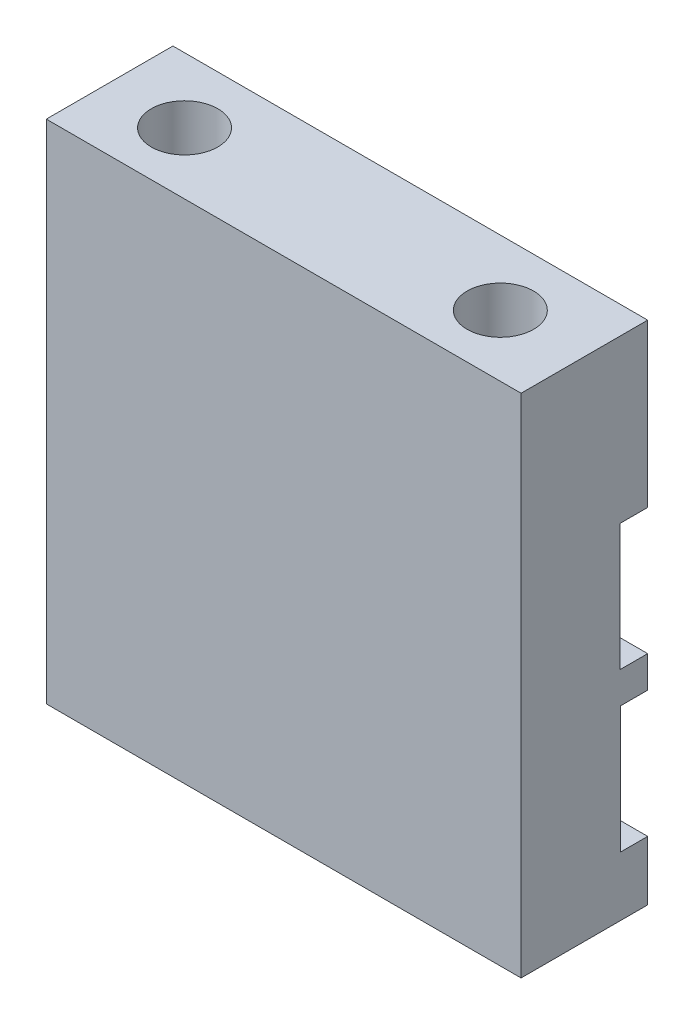
from build123d import *

# Parameters (mm, degrees)
BOSS_EXTRUDE1_DEPTH      = 8
BOSS_EXTRUDE1_DEPTH_BACK = 0.001
SKETCH1_W                = 30
SKETCH1_H                = 32
SKETCH3_W                = 1.75
SKETCH3_H                = 8
SKETCH3_W_2              = 1.716544358
CUT_EXTRUDE1_DEPTH       = 35.928498393
SKETCH4_R                = 2.1
CUT_EXTRUDE2_DEPTH       = 6


with BuildPart() as part:
    # Sketch1 → Boss-Extrude1 (new, two sides: drawn at the far end of the back side and taken through both)
    with BuildSketch(Plane.XY.offset(-BOSS_EXTRUDE1_DEPTH_BACK)):
        Rectangle(SKETCH1_W, SKETCH1_H)
    extrude(amount=BOSS_EXTRUDE1_DEPTH + BOSS_EXTRUDE1_DEPTH_BACK)

    # Sketch3 → Cut-Extrude1 (cut, through all)
    with BuildSketch(Plane.ZY.offset(15)):
        with Locations((0.874, 1.75)):
            Rectangle(SKETCH3_W, SKETCH3_H)
        with Locations((0.857272179, -8.249968909)):
            Rectangle(SKETCH3_W_2, SKETCH3_H)
    extrude(amount=-CUT_EXTRUDE1_DEPTH, mode=Mode.SUBTRACT)

    # Sketch4 → Cut-Extrude2 (cut)
    with BuildSketch(Plane(origin=(0, 16, 0), x_dir=(1, 0, 0), z_dir=(0, 1, 0))):
        with Locations(Location((-10.153172438, -4.11086305, 0), (0, 0, 270))):
            Circle(SKETCH4_R)
        with Locations(Location((9.800813668, -4.11086305, 0), (0, 0, 270))):
            Circle(SKETCH4_R)
    extrude(amount=-CUT_EXTRUDE2_DEPTH, mode=Mode.SUBTRACT)


solid = part.part
